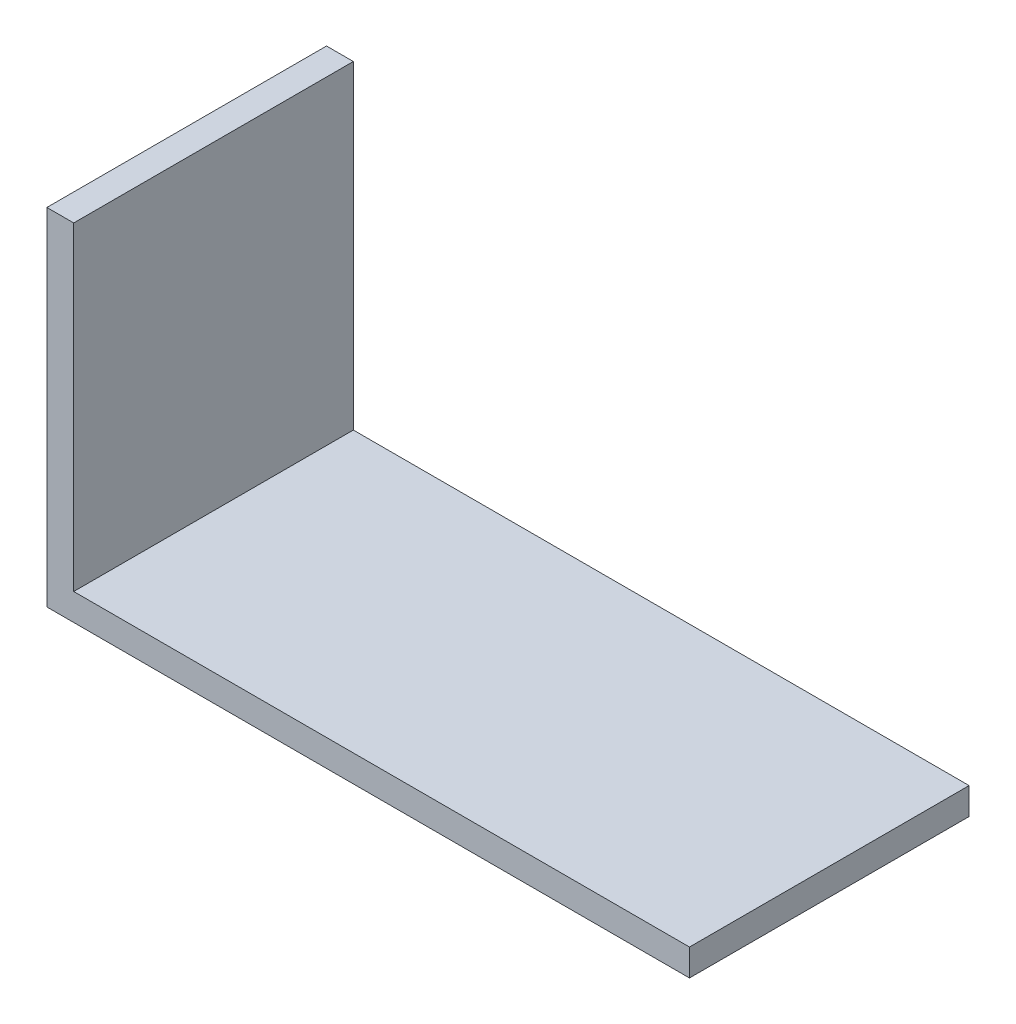
from build123d import *

# Parameters (mm, degrees)
EXTRU_MINCE1_DEPTH = 198


with BuildPart() as part:
    # Esquisse1 → Extru.-Mince1 (new body)
    with BuildSketch(Plane.XY):
        Polygon((0, 245), (0, 0), (455, 0), (455, 19), (19, 19), (19, 245), align=None)
    extrude(amount=EXTRU_MINCE1_DEPTH)


solid = part.part
